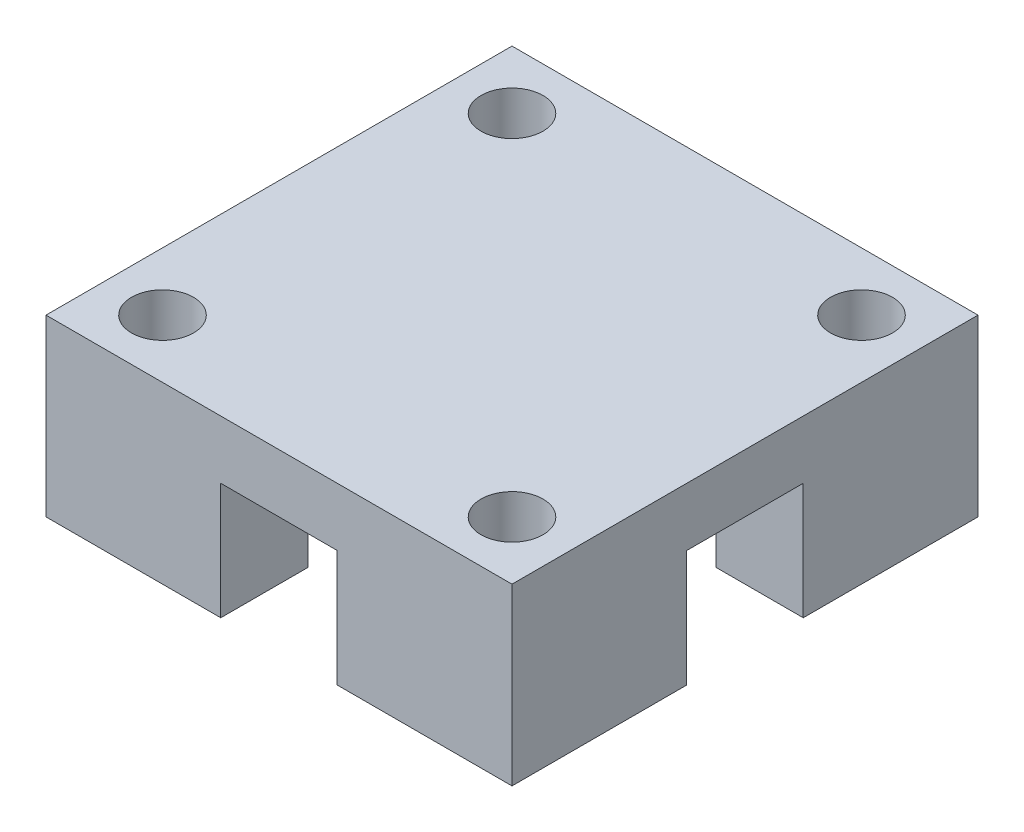
from build123d import *

# Parameters (mm, degrees)
SKETCH1_W               = 50.8
SKETCH1_H               = 50.8
BOSS_EXTRUDE1_DEPTH     = 19.05
F_1_4_CLEARANCE_HOLE1_D = 6.7564
SKETCH9_W               = 12.7
SKETCH9_H               = 50.8
SKETCH9_W_2             = 50.8
SKETCH9_H_2             = 12.7
SKETCH9_W_3             = 31.75
SKETCH9_H_3             = 31.75
CUT_EXTRUDE1_DEPTH      = 12.7


with BuildPart() as part:
    # Sketch1 → Boss-Extrude1 (new body)
    with BuildSketch(Plane(origin=(0, 0, 0), x_dir=(1, 0, 0), z_dir=(0, 1, 0))):
        Rectangle(SKETCH1_W, SKETCH1_H)
    extrude(amount=BOSS_EXTRUDE1_DEPTH)

    # 1/4 Clearance Hole1 (through all)
    with Locations(Plane(origin=(0, 19.05, 0), x_dir=(1, 0, 0), z_dir=(0, 1, 0))):
        with Locations((-19.05, 19.05), (19.05, 19.05), (19.05, -19.05), (-19.05, -19.05)):
            Hole(F_1_4_CLEARANCE_HOLE1_D / 2)

    # Sketch9 → Cut-Extrude1 (cut)
    with BuildSketch(Plane.XZ):
        Rectangle(SKETCH9_W, SKETCH9_H)
        Rectangle(SKETCH9_W_2, SKETCH9_H_2)
        Rectangle(SKETCH9_W_3, SKETCH9_H_3)
    extrude(amount=-CUT_EXTRUDE1_DEPTH, mode=Mode.SUBTRACT)


solid = part.part
